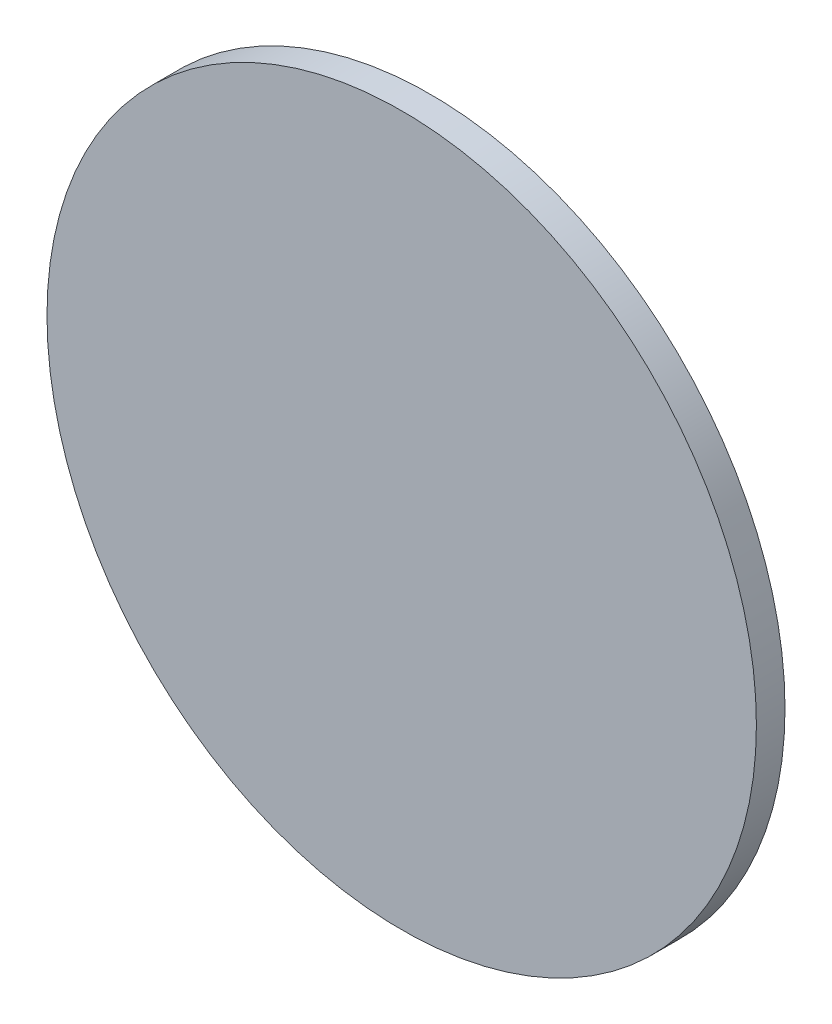
from build123d import *


with BuildPart() as part:
    # Sketch2 → Revolve1 (revolve)
    with BuildSketch(Plane(origin=(0, 0, 0), x_dir=(1, 0, 0), z_dir=(0, 1, 0)), mode=Mode.PRIVATE) as revolve1_sk:
        Polygon((0, 0), (0, 5), (38.95, 5), (38.95, 2), (44.45, 2), (44.45, 5), (51, 5), (51, 2), (57, 2), (57, 5), (62, 5), (62, 0), align=None)
    revolve(revolve1_sk.sketch.rotate(Axis((0, 0, 0), (0, 0, 1)), 180), axis=Axis((0, 0, 0), (0, 0, 1)))


solid = part.part
